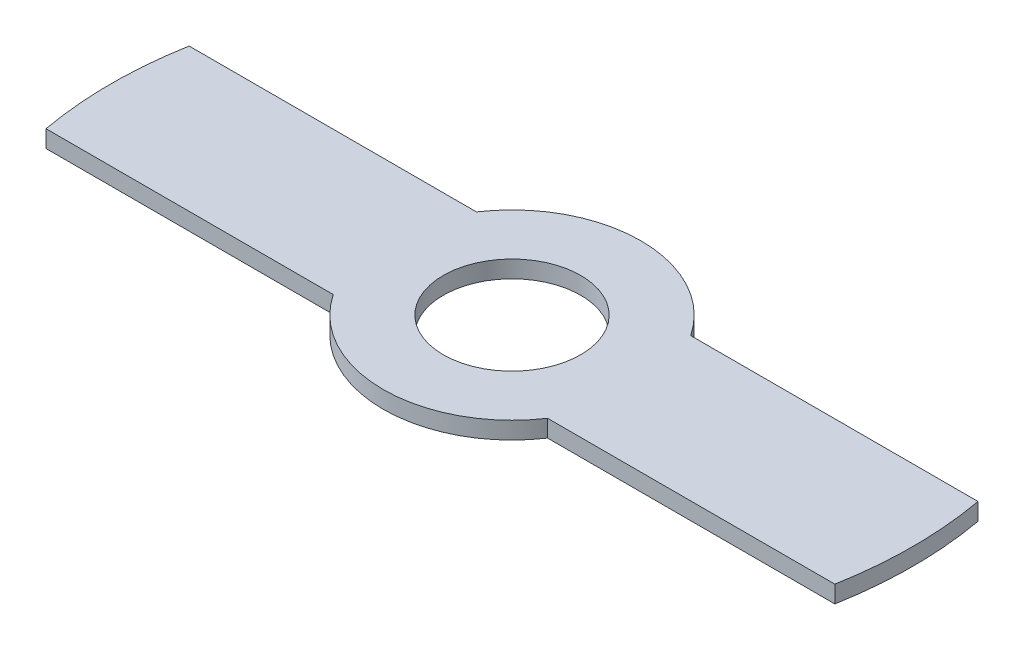
from build123d import *

# Parameters (mm, degrees)
CROQUIS1_R              = 12
SALIENTE_EXTRUIR1_DEPTH = 3


with BuildPart() as part:
    # Croquis1 → Saliente-Extruir1 (new body)
    with BuildSketch(Plane(origin=(0, 0, 0), x_dir=(1, 0, 0), z_dir=(0, 1, 0))):
        with BuildLine():
            Line((-18.708286934, 12.5), (-68.87488657, 12.5))
            ThreePointArc((-68.87488657, 12.5), (-70, 0), (-68.87488657, -12.5))
            Line((-68.87488657, -12.5), (-18.708286934, -12.5))
            ThreePointArc((-18.708286934, -12.5), (0, -22.5), (18.708286934, -12.5))
            Line((18.708286934, -12.5), (68.87488657, -12.5))
            ThreePointArc((68.87488657, -12.5), (70, 0), (68.87488657, 12.5))
            Line((68.87488657, 12.5), (18.708286934, 12.5))
            ThreePointArc((18.708286934, 12.5), (0, 22.5), (-18.708286934, 12.5))
        make_face()
        with Locations(Location((0, 0, 0), (0, 0, 270))):
            Circle(CROQUIS1_R, mode=Mode.SUBTRACT)
    extrude(amount=SALIENTE_EXTRUIR1_DEPTH)


solid = part.part
